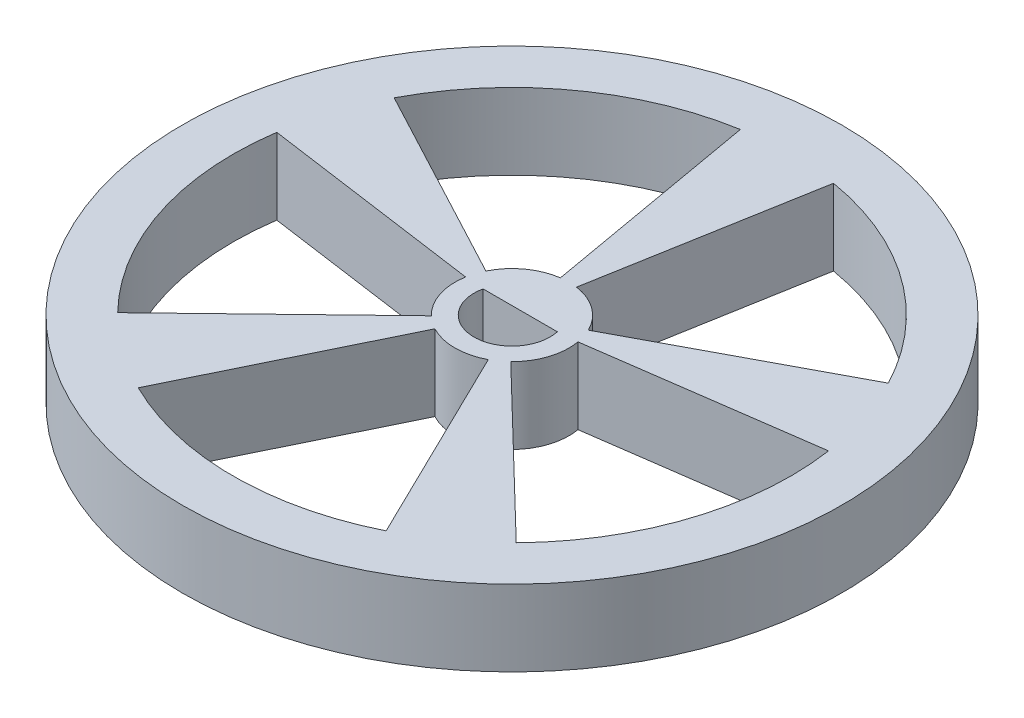
from build123d import *

# Parameters (mm, degrees)
SKETCH1_R           = 26
BOSS_EXTRUDE1_DEPTH = 6
SKETCH1_4_R         = 3
BOSS_EXTRUDE2_DEPTH = 0.6


with BuildPart() as part:
    # Sketch1 → Boss-Extrude1 (new body)
    with BuildSketch(Plane(origin=(0, 0, 0), x_dir=(1, 0, 0), z_dir=(0, 1, 0))):
        Circle(SKETCH1_R)
        with BuildLine():
            Line((-2.928736929, 0.65), (2.928736929, 0.65))
            ThreePointArc((2.928736929, 0.65), (0, -3), (-2.928736929, 0.65))
        make_face(mode=Mode.SUBTRACT)
        with BuildLine():
            ThreePointArc((4.040704303, 1.980582927), (2.645033635, 3.640576475), (0.635, 4.454971942))
            Line((0.635, 4.454971942), (3.674180512, 21.691021128))
            ThreePointArc((3.674180512, 21.691021128), (12.93127555, 17.798373876), (19.49400277, 10.197247472))
            Line((19.49400277, 10.197247472), (4.040704303, 1.980582927))
        make_face(mode=Mode.SUBTRACT)
        with BuildLine():
            Line((4.433155886, 0.772741152), (21.764771207, 3.208540836))
            ThreePointArc((21.764771207, 3.208540836), (20.923243358, -6.798373876), (15.722136801, -15.388775598))
            Line((15.722136801, -15.388775598), (3.132292598, -3.230904375))
            ThreePointArc((3.132292598, -3.230904375), (4.279754323, -1.390576475), (4.433155886, 0.772741152))
        make_face(mode=Mode.SUBTRACT)
        with BuildLine():
            ThreePointArc((-2.104841015, -3.977391645), (0, -4.5), (2.104841015, -3.977391645))
            Line((2.104841015, -3.977391645), (9.777187851, -19.708033837))
            ThreePointArc((9.777187851, -19.708033837), (0, -22), (-9.777187851, -19.708033837))
            Line((-9.777187851, -19.708033837), (-2.104841015, -3.977391645))
        make_face(mode=Mode.SUBTRACT)
        with BuildLine():
            ThreePointArc((-4.433155886, 0.772741152), (-4.279754323, -1.390576475), (-3.132292598, -3.230904375))
            Line((-3.132292598, -3.230904375), (-15.722136801, -15.388775598))
            ThreePointArc((-15.722136801, -15.388775598), (-20.923243358, -6.798373876), (-21.764771207, 3.208540836))
            Line((-21.764771207, 3.208540836), (-4.433155886, 0.772741152))
        make_face(mode=Mode.SUBTRACT)
        with BuildLine():
            ThreePointArc((-0.635, 4.454971942), (-2.645033635, 3.640576475), (-4.040704303, 1.980582927))
            Line((-4.040704303, 1.980582927), (-19.49400277, 10.197247472))
            ThreePointArc((-19.49400277, 10.197247472), (-12.93127555, 17.798373876), (-3.674180512, 21.691021128))
            Line((-3.674180512, 21.691021128), (-0.635, 4.454971942))
        make_face(mode=Mode.SUBTRACT)
    extrude(amount=BOSS_EXTRUDE1_DEPTH)

    # Sketch1<4> → Boss-Extrude2 (add)
    with BuildSketch(Plane(origin=(0, 0, 0), x_dir=(1, 0, 0), z_dir=(0, 1, 0))):
        Circle(SKETCH1_4_R)
    extrude(amount=BOSS_EXTRUDE2_DEPTH)


solid = part.part
